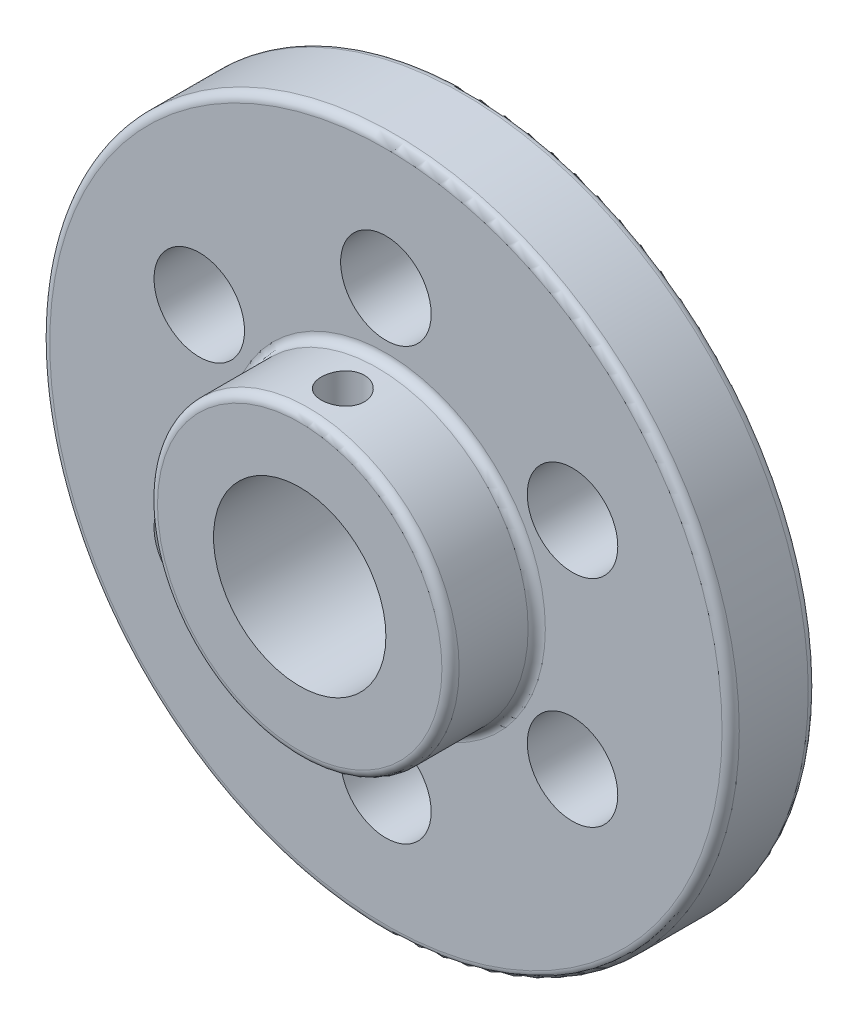
from build123d import *

# Parameters (mm, degrees)
SKETCH1_R                  = 40
SKETCH1_R_2                = 10
BOSS_EXTRUDE1_DEPTH        = 10
M12X1_5_TAPPED_HOLE1_D     = 10.5
CIRPATTERN1_COUNT          = 6
SKETCH5_R                  = 17.5
SKETCH5_R_2                = 10
BOSS_EXTRUDE2_DEPTH        = 10
M6X1_0_TAPPED_HOLE1_REACH  = 74.844
M6X1_0_TAPPED_HOLE1_BORE_R = 2.5
FILLET1_R                  = 1


with BuildPart() as part:
    # Sketch1 → Boss-Extrude1 (new body)
    with BuildSketch(Plane.XY):
        Circle(SKETCH1_R)
        Circle(SKETCH1_R_2, mode=Mode.SUBTRACT)
    extrude(amount=BOSS_EXTRUDE1_DEPTH)

    # M12x1.5 Tapped Hole1 (through all)
    with Locations(Plane.XY.offset(10)):
        with Locations((0, 25)):
            m12x1_5_tapped_hole1 = Hole(M12X1_5_TAPPED_HOLE1_D / 2)

    # CirPattern1: M12x1.5 Tapped Hole1 ×6 about axis
    cirpattern1_axis = Axis((0, 0, 0), (0, 0, 1))
    for i in range(1, CIRPATTERN1_COUNT):
        add(m12x1_5_tapped_hole1.rotate(cirpattern1_axis, i * 360 / CIRPATTERN1_COUNT), mode=Mode.SUBTRACT)

    # Sketch5 → Boss-Extrude2 (add)
    with BuildSketch(Plane.XY.offset(10)):
        Circle(SKETCH5_R)
        Circle(SKETCH5_R_2, mode=Mode.SUBTRACT)
    extrude(amount=BOSS_EXTRUDE2_DEPTH)

    # M6x1.0 Tapped Hole1 bore → M6x1.0 Tapped Hole1 (cut, up to next)
    with BuildSketch(Plane(origin=(0, 17.5, 0), x_dir=(1, 0, 0), z_dir=(0, 1, 0)), mode=Mode.PRIVATE) as m6x1_0_tapped_hole1_sk1:
        with Locations((0, -15)):
            Circle(M6X1_0_TAPPED_HOLE1_BORE_R)
    m6x1_0_tapped_hole1_tool1 = extrude(m6x1_0_tapped_hole1_sk1.sketch, amount=-M6X1_0_TAPPED_HOLE1_REACH, mode=Mode.PRIVATE) & part.part
    add(m6x1_0_tapped_hole1_tool1.solids().sort_by_distance((0, 17.5, 15))[0], mode=Mode.SUBTRACT)

    # Fillet1
    fillet1_edges = [part.edges().sort_by_distance(p)[0] for p in [
        (-40, 0, 0),
        (-17.5, 0, 10),
        (-17.5, 0, 20),
        (-40, 0, 10),
    ]]
    fillet(fillet1_edges, radius=FILLET1_R)


solid = part.part
